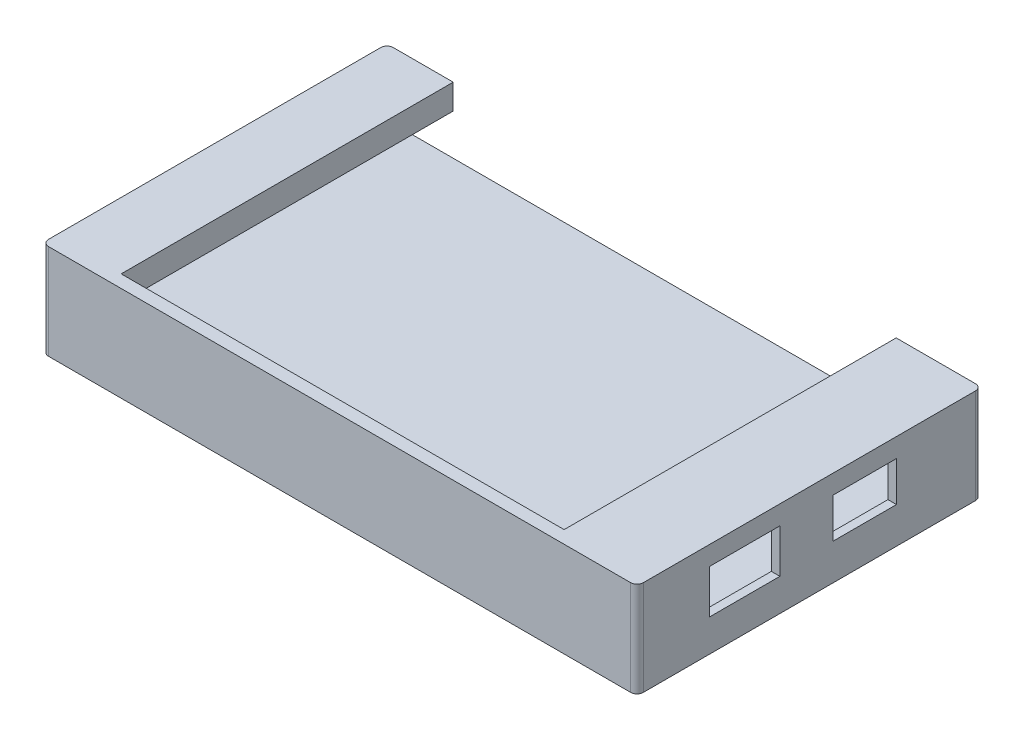
from build123d import *

# Parameters (mm, degrees)
SKETCH1_W           = 93.85
SKETCH1_H           = 54.4
SKETCH1_W_2         = 89.85
SKETCH1_H_2         = 50.4
SKETCH1_W_3         = 8.5
SKETCH1_W_4         = 72.85
BOSS_EXTRUDE1_DEPTH = 2
SKETCH2_W           = 93.85
SKETCH2_H           = 54.4
SKETCH2_W_2         = 86
SKETCH2_H_2         = 50
BOSS_EXTRUDE2_DEPTH = 10
SKETCH3_W           = 8.45
SKETCH3_H           = 50
SKETCH3_W_2         = 69.9
SKETCH3_H_2         = 2
SKETCH3_W_3         = 7.65
BOSS_EXTRUDE3_DEPTH = 3
SKETCH5_W           = 10
SKETCH5_H           = 6.29
SKETCH5_W_2         = 11.1
SKETCH5_H_2         = 6.9
CUT_EXTRUDE1_DEPTH  = 5.85
SKETCH6_W           = 86
SKETCH6_H           = 50
BOSS_EXTRUDE4_DEPTH = 2.6
SKETCH8_W           = 86
SKETCH8_H           = 7.4
CUT_EXTRUDE2_DEPTH  = 2.4
SKETCH9_W           = 7.65
SKETCH9_H           = 52.4
SKETCH9_W_2         = 8.45
BOSS_EXTRUDE5_DEPTH = 0.95
SKETCH13_W          = 52.4
SKETCH13_H          = 6.45
CUT_EXTRUDE4_DEPTH  = 3
SKETCH14_W          = 52.4
SKETCH14_H          = 6.45
CUT_EXTRUDE5_DEPTH  = 1.5
FILLET1_R           = 2
FILLET2_R           = 1


with BuildPart() as part:
    # Sketch1 → Boss-Extrude1 (new body)
    # profile 1 of 4: a face of its own
    with BuildSketch(Plane(origin=(0, 0, 0), x_dir=(1, 0, 0), z_dir=(0, 1, 0))):
        with Locations((44.925, 25.2)):
            Rectangle(SKETCH1_W, SKETCH1_H)
        with Locations((44.925, 25.2)):
            Rectangle(SKETCH1_W_2, SKETCH1_H_2, mode=Mode.SUBTRACT)
    # profile 2 of 4: a face of its own
    with BuildSketch(Plane(origin=(0, 0, 0), x_dir=(1, 0, 0), z_dir=(0, 1, 0))):
        with Locations((4.25, 25.2)):
            Rectangle(SKETCH1_W_3, SKETCH1_H_2)
    # profile 3 of 4: a face of its own
    with BuildSketch(Plane(origin=(0, 0, 0), x_dir=(1, 0, 0), z_dir=(0, 1, 0))):
        with Locations((44.925, 25.2)):
            Rectangle(SKETCH1_W_4, SKETCH1_H_2)
    # profile 4 of 4: a face of its own
    with BuildSketch(Plane(origin=(0, 0, 0), x_dir=(1, 0, 0), z_dir=(0, 1, 0))):
        with Locations((85.6, 25.2)):
            Rectangle(SKETCH1_W_3, SKETCH1_H_2)
    extrude(amount=BOSS_EXTRUDE1_DEPTH)

    # Sketch2 → Boss-Extrude2 (add)
    with BuildSketch(Plane(origin=(0, 2, 0), x_dir=(1, 0, 0), z_dir=(0, 1, 0))):
        with Locations((44.925, 25.2)):
            Rectangle(SKETCH2_W, SKETCH2_H)
        with Locations((43, 25)):
            Rectangle(SKETCH2_W_2, SKETCH2_H_2, mode=Mode.SUBTRACT)
    extrude(amount=BOSS_EXTRUDE2_DEPTH)

    # Sketch3 → Boss-Extrude3 (add)
    with BuildSketch(Plane(origin=(0, 12, 0), x_dir=(1, 0, 0), z_dir=(0, 1, 0))):
        with Locations((4.225, 25)):
            Rectangle(SKETCH3_W, SKETCH3_H)
        Polygon((8.45, 52.4), (-2, 52.4), (-2, -2), (8.45, -2), (8.45, 0), (0, 0), (0, 50), (8.45, 50), align=None)
        with Locations((43.4, -1)):
            Rectangle(SKETCH3_W_2, SKETCH3_H_2)
        with Locations((82.175, 25)):
            Rectangle(SKETCH3_W_3, SKETCH3_H)
        Polygon((91.85, 52.4), (78.35, 52.4), (78.35, 50), (86, 50), (86, 0), (78.35, 0), (78.35, -2), (91.85, -2), align=None)
    extrude(amount=BOSS_EXTRUDE3_DEPTH)

    # Sketch5 → Cut-Extrude1 (cut)
    with BuildSketch(Plane.ZY.offset(-86)):
        with Locations((-33.95, 8.845)):
            Rectangle(SKETCH5_W, SKETCH5_H)
        with Locations((-15, 8.54)):
            Rectangle(SKETCH5_W_2, SKETCH5_H_2)
    extrude(amount=-CUT_EXTRUDE1_DEPTH, mode=Mode.SUBTRACT)

    # Sketch6 → Boss-Extrude4 (add)
    with BuildSketch(Plane(origin=(0, 2, 0), x_dir=(1, 0, 0), z_dir=(0, 1, 0))):
        with Locations((43, 25)):
            Rectangle(SKETCH6_W, SKETCH6_H)
    extrude(amount=BOSS_EXTRUDE4_DEPTH)

    # Sketch8 → Cut-Extrude2 (cut)
    with BuildSketch(Plane.XY.offset(-50)):
        with Locations((43, 8.3)):
            Rectangle(SKETCH8_W, SKETCH8_H)
    extrude(amount=-CUT_EXTRUDE2_DEPTH, mode=Mode.SUBTRACT)

    # Sketch9 → Boss-Extrude5 (add)
    with BuildSketch(Plane.XZ.offset(-12)):
        with Locations((82.175, -26.2)):
            Rectangle(SKETCH9_W, SKETCH9_H)
        with Locations((4.225, -26.2)):
            Rectangle(SKETCH9_W_2, SKETCH9_H)
    extrude(amount=BOSS_EXTRUDE5_DEPTH)

    # Sketch13 → Cut-Extrude4 (cut)
    with BuildSketch(Plane.ZY.offset(-86)):
        with Locations((-26.2, 7.825)):
            Rectangle(SKETCH13_W, SKETCH13_H)
    extrude(amount=-CUT_EXTRUDE4_DEPTH, mode=Mode.SUBTRACT)

    # Sketch14 → Cut-Extrude5 (cut)
    with BuildSketch(Plane.ZY.offset(-89)):
        with Locations((-26.2, 7.825)):
            Rectangle(SKETCH14_W, SKETCH14_H)
    extrude(amount=-CUT_EXTRUDE5_DEPTH, mode=Mode.SUBTRACT)

    # Fillet1
    fillet1_edges = [part.edges().sort_by_distance(p)[0] for p in [
        (0, 7.825, 0),
        (90.5, 7.825, 0),
    ]]
    fillet(fillet1_edges, radius=FILLET1_R)

    # Fillet2
    fillet2_edges = [part.edges().sort_by_distance(p)[0] for p in [
        (91.85, 7.5, 2),
        (-2, 7.5, 2),
        (-2, 7.5, -52.4),
        (91.85, 7.5, -52.4),
    ]]
    fillet(fillet2_edges, radius=FILLET2_R)


solid = part.part
